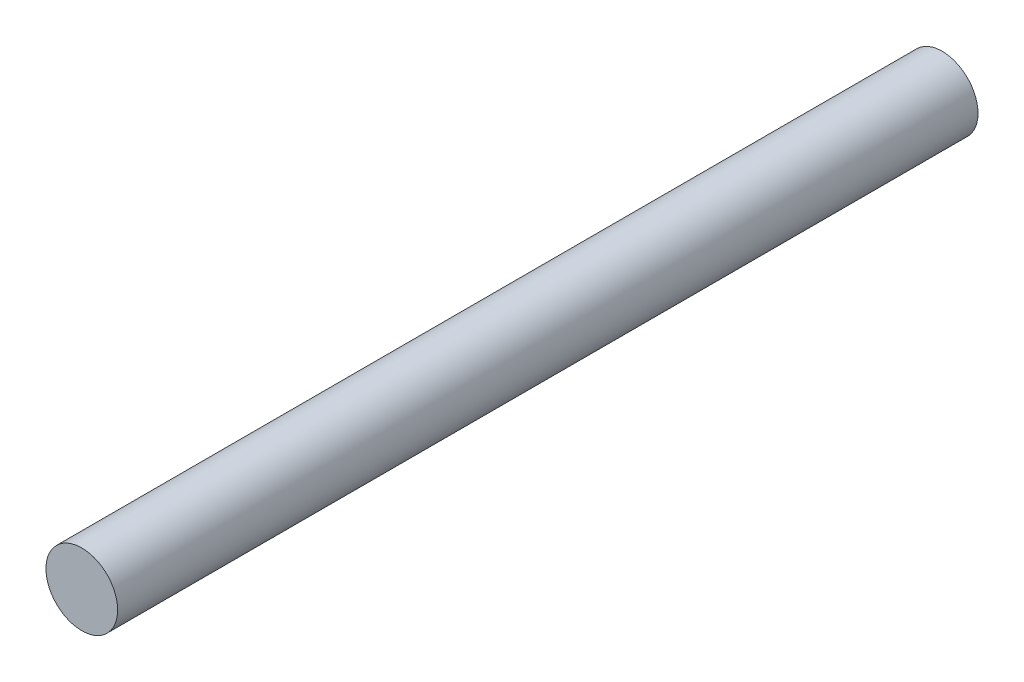
from build123d import *

# Parameters (mm, degrees)
SKETCH1_R           = 1
BOSS_EXTRUDE1_DEPTH = 24


with BuildPart() as part:
    # Sketch1 → Boss-Extrude1 (new body)
    with BuildSketch(Plane.XY):
        Circle(SKETCH1_R)
    extrude(amount=BOSS_EXTRUDE1_DEPTH)


solid = part.part
